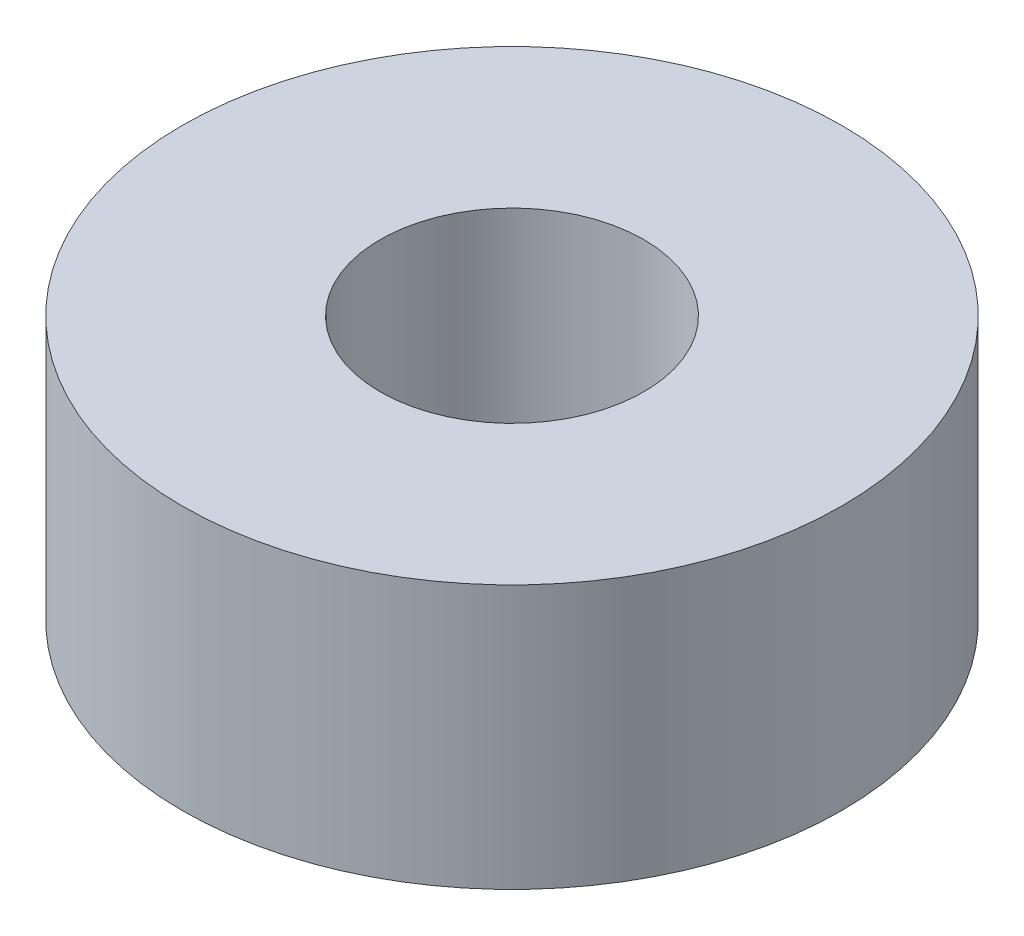
from build123d import *

# Parameters (mm, degrees)
SKETCH1_R           = 5
SKETCH1_R_2         = 2
BOSS_EXTRUDE1_DEPTH = 4


with BuildPart() as part:
    # Sketch1 → Boss-Extrude1 (new body)
    with BuildSketch(Plane(origin=(0, 0, 0), x_dir=(1, 0, 0), z_dir=(0, 1, 0))):
        with Locations(Location((0, 0, 0), (0, 0, 270))):
            Circle(SKETCH1_R)
        with Locations(Location((0, 0, 0), (0, 0, 270))):
            Circle(SKETCH1_R_2, mode=Mode.SUBTRACT)
    extrude(amount=BOSS_EXTRUDE1_DEPTH)


solid = part.part
